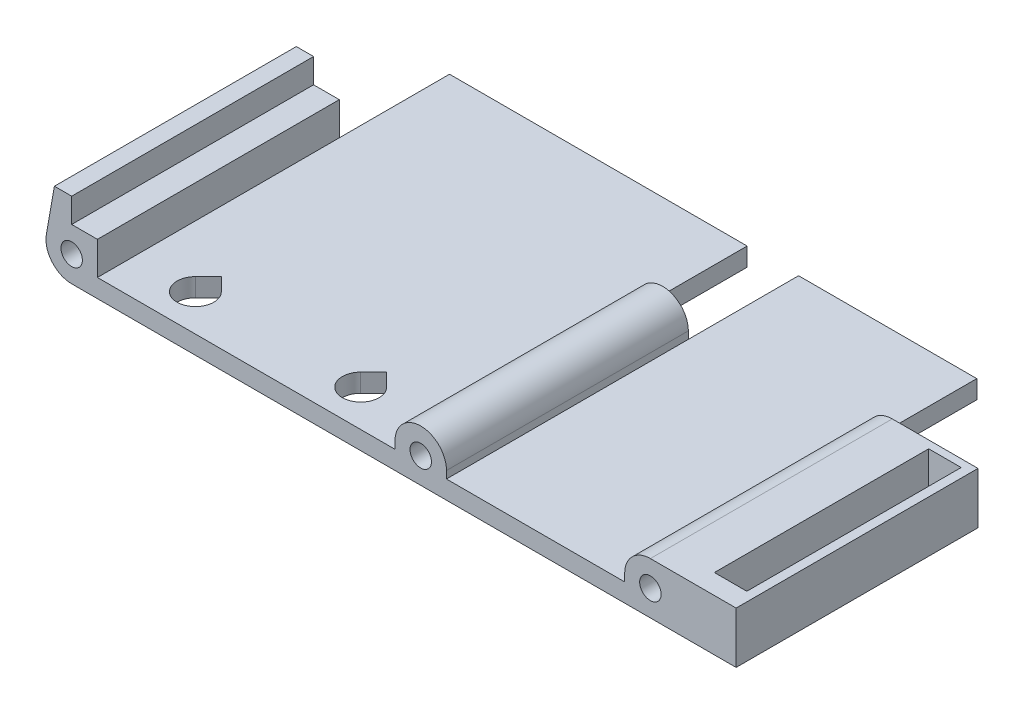
from build123d import *

# Parameters (mm, degrees)
SKETCH1_R           = 1.75
BOSS_EXTRUDE1_DEPTH = 57.5
BOSS_EXTRUDE2_DEPTH = 8.4
SKETCH3_W           = 5.3
SKETCH3_H           = 35
CUT_EXTRUDE1_DEPTH  = 5.4
CUT_EXTRUDE2_DEPTH  = 85.49881656
SKETCH5_W           = 18.2
SKETCH5_H           = 8.4
SKETCH5_W_2         = 8.4
SKETCH5_H_2         = 8.937392322
SKETCH5_W_3         = 9.875614017
SKETCH5_H_3         = 12.4
CUT_EXTRUDE3_DEPTH  = 18
LPATTERN1_COUNT     = 2
LPATTERN1_PITCH     = 27


with BuildPart() as part:
    # Sketch1 → Boss-Extrude1 (new body)
    with BuildSketch(Plane.XY):
        with BuildLine():
            Line((-52.8, -1.2), (-4.2, -1.2))
            Line((-4.2, -1.2), (-4.2, 0))
            ThreePointArc((-4.2, 0), (0, 4.2), (4.2, 0))
            Line((4.2, 0), (4.2, -1.2))
            Line((4.2, -1.2), (33.3, -1.2))
            Line((33.3, -1.2), (33.3, 0))
            ThreePointArc((33.3, 0), (34.530151519, 2.969848481), (37.5, 4.2))
            Line((37.5, 4.2), (41.5, 4.2))
            Line((41.5, 4.2), (41.5, -4.2))
            Line((41.5, -4.2), (-57, -4.2))
            ThreePointArc((-57, -4.2), (-60.217386661, -2.699707961), (-61.136192563, 0.729322346))
            Line((-61.136192563, 0.729322346), (-59.818910528, 8.2))
            Line((-59.818910528, 8.2), (-57, 8.2))
            Line((-57, 8.2), (-57, 4.2))
            Line((-57, 4.2), (-52.8, 4.2))
            Line((-52.8, 4.2), (-52.8, -1.2))
        make_face()
        Circle(SKETCH1_R, mode=Mode.SUBTRACT)
        with Locations((-57, 0)):
            Circle(SKETCH1_R, mode=Mode.SUBTRACT)
        with Locations((37.5, 0)):
            Circle(SKETCH1_R, mode=Mode.SUBTRACT)
    extrude(amount=BOSS_EXTRUDE1_DEPTH)

    # Sketch2 → Boss-Extrude2 (add)
    with BuildSketch(Plane(origin=(0, 4.2, 0), x_dir=(1, 0, 0), z_dir=(0, 1, 0))):
        Polygon((41.5, -57.5), (51.5, -57.5), (51.5, -17.5), (41.5, 0), align=None)
    extrude(amount=-BOSS_EXTRUDE2_DEPTH)

    # Sketch3 → Cut-Extrude1 (cut)
    with BuildSketch(Plane(origin=(0, 4.2, 0), x_dir=(1, 0, 0), z_dir=(0, 1, 0))):
        with Locations((47.35, -36.75)):
            Rectangle(SKETCH3_W, SKETCH3_H)
    extrude(amount=-CUT_EXTRUDE1_DEPTH, mode=Mode.SUBTRACT)

    # Sketch4 → Cut-Extrude2 (cut, through all)
    with BuildSketch(Plane(origin=(0, -1.2, 0), x_dir=(1, 0, 0), z_dir=(0, 1, 0))):
        with BuildLine():
            Line((-44.921320344, -49.378679656), (-42.8, -47.257359313))
            Line((-42.8, -47.257359313), (-40.678679656, -49.378679656))
            ThreePointArc((-40.678679656, -49.378679656), (-42.8, -54.5), (-44.921320344, -49.378679656))
        make_face()
    cut_extrude2 = extrude(amount=-CUT_EXTRUDE2_DEPTH, mode=Mode.SUBTRACT)

    # Sketch5 → Cut-Extrude3 (cut)
    with BuildSketch(Plane(origin=(0, 0, 0), x_dir=(-1, 0, 0), z_dir=(0, 0, -1))):
        with Locations((-42.4, 0)):
            Rectangle(SKETCH5_W, SKETCH5_H)
        with Locations((0, 0.268696161)):
            Rectangle(SKETCH5_W_2, SKETCH5_H_2)
        with Locations((57.737807008, 2)):
            Rectangle(SKETCH5_W_3, SKETCH5_H_3)
    extrude(amount=-CUT_EXTRUDE3_DEPTH, mode=Mode.SUBTRACT)

    # LPattern1: Cut-Extrude2 ×2
    with Locations(*[(i * LPATTERN1_PITCH, 0, 0) for i in range(1, LPATTERN1_COUNT)]):
        add(cut_extrude2, mode=Mode.SUBTRACT)


solid = part.part
